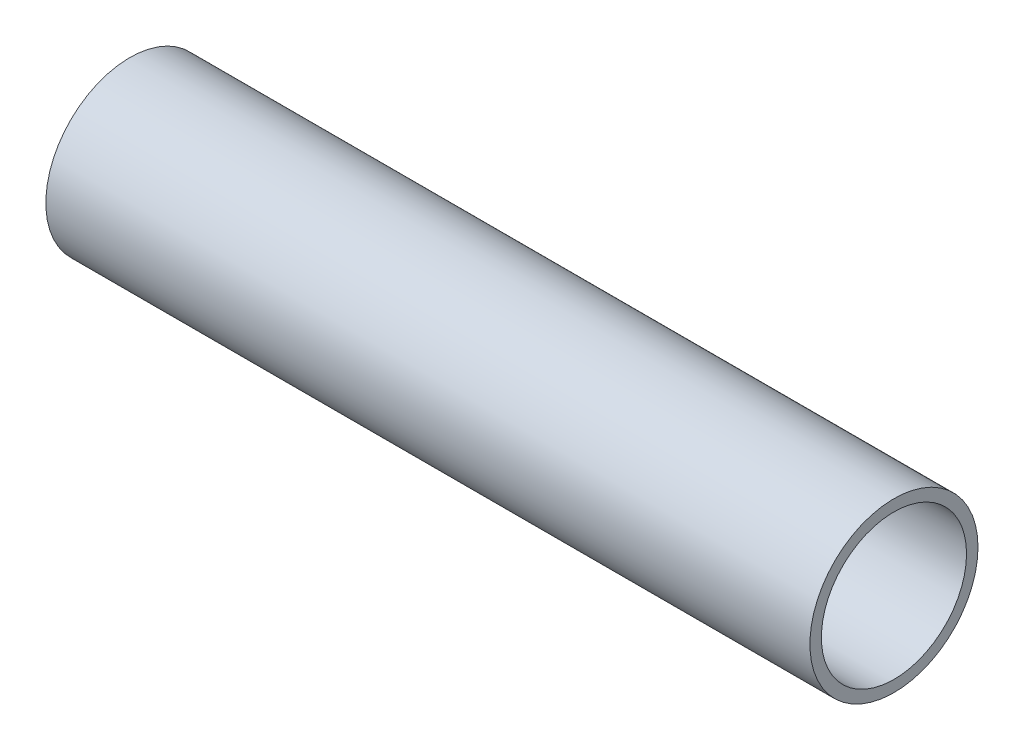
from build123d import *

# Parameters (mm, degrees)
SKETCH1_R           = 11
SKETCH1_R_2         = 9.5
BOSS_EXTRUDE1_DEPTH = 100


with BuildPart() as part:
    # Sketch1 → Boss-Extrude1 (new body)
    with BuildSketch(Plane(origin=(0, 0, 0), x_dir=(0, 0, -1), z_dir=(1, 0, 0))):
        Circle(SKETCH1_R)
        Circle(SKETCH1_R_2, mode=Mode.SUBTRACT)
    extrude(amount=BOSS_EXTRUDE1_DEPTH)


solid = part.part
